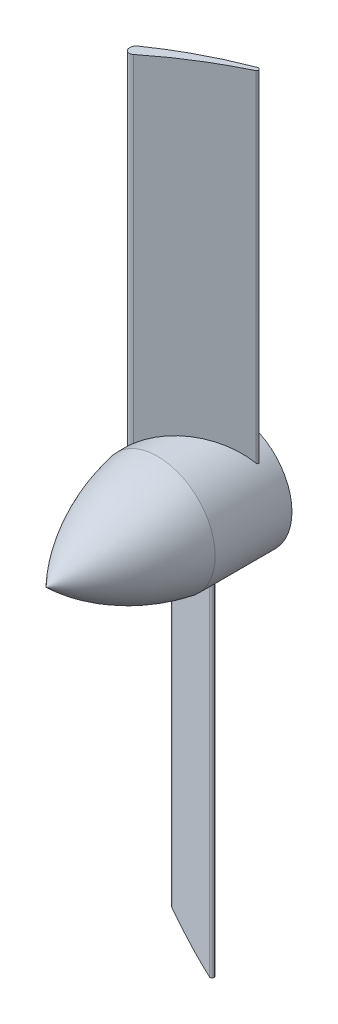
from build123d import *

# Parameters (mm, degrees)
BOSS_EXTRUDE1_DEPTH     = 127
BOSS_EXTRUDE2_DEPTH     = 127
CUT_EXTRUDE1_DEPTH      = 127
CUT_EXTRUDE1_DEPTH_BACK = 127
SKETCH4_R               = 136.434593374
SKETCH4_R_2             = 127
SKETCH6_R               = 12.7
CUT_EXTRUDE2_DEPTH      = 12.7


with BuildPart() as part:
    # Sketch1 → Boss-Extrude1 (new body)
    with BuildSketch(Plane(origin=(0, 0, 0), x_dir=(1, 0, 0), z_dir=(0, 1, 0))):
        with BuildLine():
            Line((-11.676956204, -21.639331743), (13.041014599, -5.903317248))
            ThreePointArc((13.041014599, -5.903317248), (13.249926196, -5.050155111), (12.406610412, -4.804496452))
            Line((12.406610412, -4.804496452), (-13.580168763, -18.342869357))
            ThreePointArc((-13.580168763, -18.342869357), (-14.349778587, -20.984844667), (-11.676956204, -21.639331743))
        make_face()
    extrude(amount=BOSS_EXTRUDE1_DEPTH)

    # Sketch3 → Boss-Extrude2 (add)
    with BuildSketch(Plane(origin=(0, 0, 0), x_dir=(1, 0, 0), z_dir=(0, 1, 0))):
        with BuildLine():
            Line((-13.580168763, -7.057130643), (12.406610412, -20.595503548))
            ThreePointArc((12.406610412, -20.595503548), (13.249926196, -20.349844889), (13.041014599, -19.496682752))
            Line((13.041014599, -19.496682752), (-11.676956204, -3.760668257))
            ThreePointArc((-11.676956204, -3.760668257), (-14.349778587, -4.415155333), (-13.580168763, -7.057130643))
        make_face()
    extrude(amount=-BOSS_EXTRUDE2_DEPTH)

    # Sketch4 → Cut-Extrude1 (cut, two sides: drawn at the far end of the back side and taken through both)
    with BuildSketch(Plane.XY.offset(-CUT_EXTRUDE1_DEPTH_BACK)):
        Circle(SKETCH4_R)
        Circle(SKETCH4_R_2, mode=Mode.SUBTRACT)
    extrude(amount=CUT_EXTRUDE1_DEPTH + CUT_EXTRUDE1_DEPTH_BACK, mode=Mode.SUBTRACT)

    # Sketch5 → Revolve1 (revolve)
    with BuildSketch(Plane(origin=(0, 0, 0), x_dir=(0, 0, -1), z_dir=(1, 0, 0))):
        with BuildLine():
            Line((-12.7, 0), (-12.7, 12.7))
            Line((-12.7, 12.7), (0, 12.7))
            Line((0, 12.7), (0, 19.05))
            Line((0, 19.05), (-25.4, 19.05))
            ThreePointArc((-25.4, 19.05), (-45.274681217, 12.279076677), (-62.3062, 0))
            Line((-62.3062, 0), (-12.7, 0))
        make_face()
    revolve(axis=Axis((0, 0, 1000), (0, 0, -1)))

    # Sketch6 → Cut-Extrude2 (cut)
    with BuildSketch(Plane(origin=(0, 0, 0), x_dir=(-1, 0, 0), z_dir=(0, 0, -1))):
        Circle(SKETCH6_R)
    extrude(amount=-CUT_EXTRUDE2_DEPTH, mode=Mode.SUBTRACT)


solid = part.part
